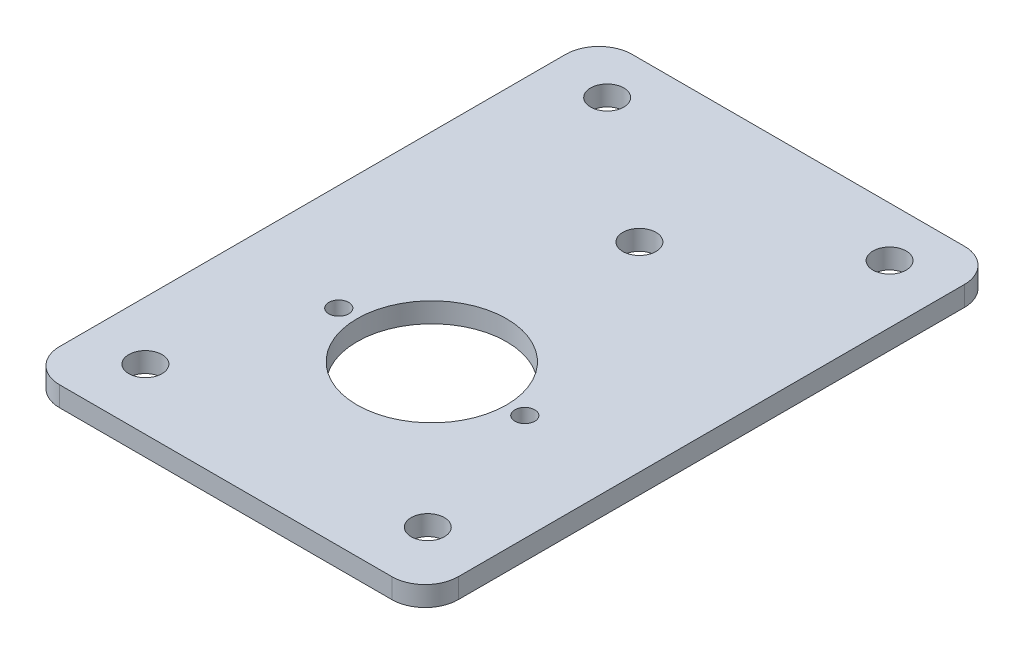
from build123d import *

# Parameters (mm, degrees)
SKETCH1_W           = 120
SKETCH1_H           = 180
BOSS_EXTRUDE1_DEPTH = 6
SKETCH2_R           = 5
CUT_EXTRUDE1_DEPTH  = 6
SKETCH4_R           = 22.5
SKETCH4_R_2         = 3
CUT_EXTRUDE3_DEPTH  = 10
SKETCH5_W           = 120
SKETCH5_H           = 7.698004818
CUT_EXTRUDE4_DEPTH  = 10
FILLET1_R           = 10


with BuildPart() as part:
    # Sketch1 → Boss-Extrude1 (new body)
    with BuildSketch(Plane(origin=(0, 0, 0), x_dir=(1, 0, 0), z_dir=(0, 1, 0))):
        Rectangle(SKETCH1_W, SKETCH1_H)
    extrude(amount=BOSS_EXTRUDE1_DEPTH)

    # Sketch2 → Cut-Extrude1 (cut)
    with BuildSketch(Plane(origin=(0, 6, 0), x_dir=(1, 0, 0), z_dir=(0, 1, 0))):
        with Locations(Location((-42.5, 75, 0), (0, 0, 270))):
            Circle(SKETCH2_R)
        with Locations(Location((42.5, 75, 0), (0, 0, 270))):
            Circle(SKETCH2_R)
        with Locations(Location((-42.5, -64, 0), (0, 0, 270))):
            Circle(SKETCH2_R)
        with Locations(Location((42.5, -64, 0), (0, 0, 270))):
            Circle(SKETCH2_R)
        with Locations(Location((0, 42.2, 0), (0, 0, 270))):
            Circle(SKETCH2_R)
    extrude(amount=-CUT_EXTRUDE1_DEPTH, mode=Mode.SUBTRACT)

    # Sketch4 → Cut-Extrude3 (cut)
    with BuildSketch(Plane(origin=(0, 6, 0), x_dir=(1, 0, 0), z_dir=(0, 1, 0))):
        with Locations(Location((0, -20.3, 0), (0, 0, 270))):
            Circle(SKETCH4_R)
        with Locations(Location((-28, -20.3, 0), (0, 0, 270))):
            Circle(SKETCH4_R_2)
        with Locations(Location((28, -20.3, 0), (0, 0, 270))):
            Circle(SKETCH4_R_2)
    extrude(amount=-CUT_EXTRUDE3_DEPTH, mode=Mode.SUBTRACT)

    # Sketch5 → Cut-Extrude4 (cut)
    with BuildSketch(Plane(origin=(0, 6, 0), x_dir=(1, 0, 0), z_dir=(0, 1, 0))):
        with Locations((0, -86.150997591)):
            Rectangle(SKETCH5_W, SKETCH5_H)
    extrude(amount=-CUT_EXTRUDE4_DEPTH, mode=Mode.SUBTRACT)

    # Fillet1
    fillet1_edges = [part.edges().sort_by_distance(p)[0] for p in [
        (-60, 3, 82.301995182),
        (60, 3, 82.301995182),
        (-60, 3, -90),
        (60, 3, -90),
    ]]
    fillet(fillet1_edges, radius=FILLET1_R)


solid = part.part
